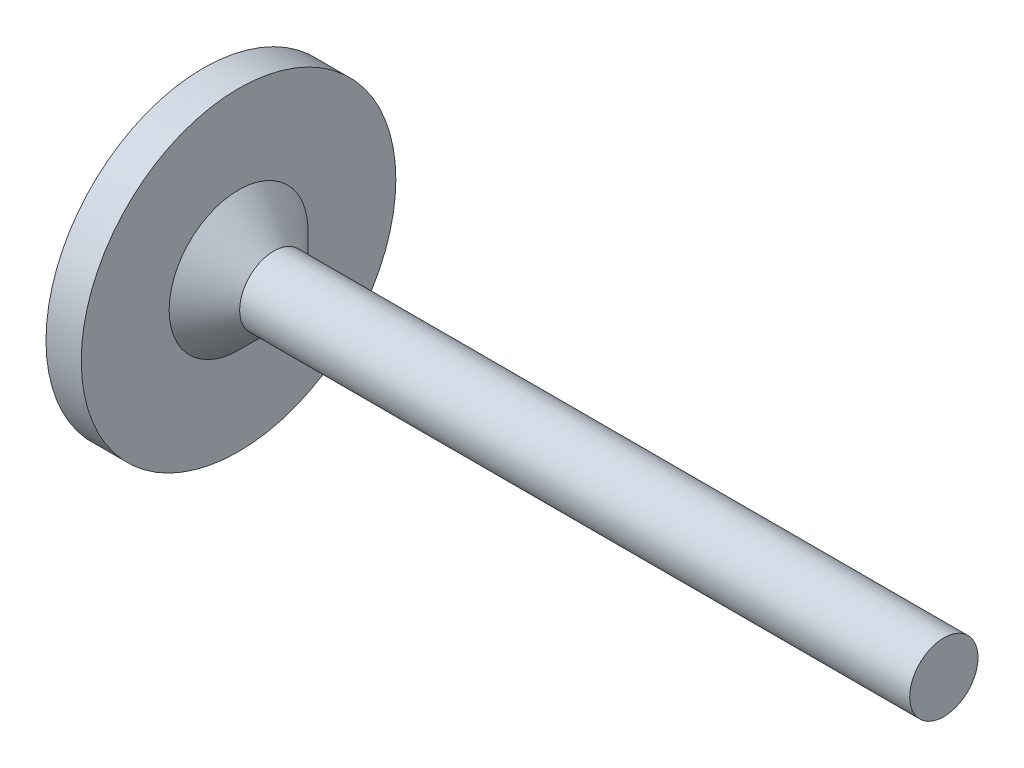
from build123d import *

# Parameters (mm, degrees)
SKETCH1_R           = 6.15
BOSS_EXTRUDE1_DEPTH = 127
SKETCH2_R           = 28.321
BOSS_EXTRUDE2_DEPTH = 6.35
CHAMFER1_SIZE       = 6.35


with BuildPart() as part:
    # Sketch1 → Boss-Extrude1 (new body)
    with BuildSketch(Plane(origin=(0, 0, 0), x_dir=(0, 0, -1), z_dir=(1, 0, 0))):
        Circle(SKETCH1_R)
    extrude(amount=BOSS_EXTRUDE1_DEPTH)

    # Sketch2 → Boss-Extrude2 (add)
    with BuildSketch(Plane.ZY):
        Circle(SKETCH2_R)
    extrude(amount=BOSS_EXTRUDE2_DEPTH)

    # Chamfer1
    chamfer1_edges = [part.edges().sort_by_distance(p)[0] for p in [
        (0, 0, 6.15),
    ]]
    chamfer(chamfer1_edges, length=CHAMFER1_SIZE)


solid = part.part
